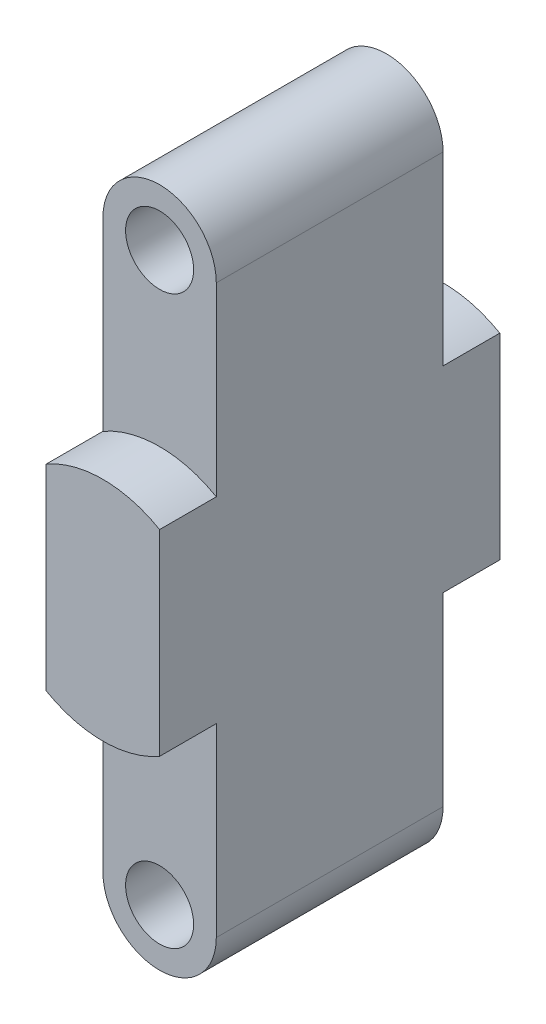
from build123d import *

# Parameters (mm, degrees)
SKETCH1_W                   = 12.7
SKETCH1_H                   = 38.1
BOSS_EXTRUDE1_DEPTH         = 19.05
FILLET2_RADIUS              = 6.35
FILLET2_LENGTH              = 38.1
SKETCH2_R                   = 3.81
CUT_EXTRUDE1_DEPTH          = 38.1
CUT_EXTRUDE2_DEPTH          = 6.35
MIRROR7_COPY_1_DEPTH        = 6.35
FILLET2_OF_MIRROR7_2_RADIUS = 6.35
FILLET2_OF_MIRROR7_2_LENGTH = 38.1


with BuildPart() as part:
    # Sketch1 → Boss-Extrude1 (new, symmetric)
    with BuildSketch(Plane.XY):
        Rectangle(SKETCH1_W, SKETCH1_H)
    boss_extrude1 = extrude(amount=BOSS_EXTRUDE1_DEPTH, both=True)

    # Fillet2: full round fillet: the end face becomes a half cylinder, R = half its width
    fillet2_face = Plane((0, -19.05, 0), x_dir=(0, 0, 1), z_dir=(0, -1, 0))  # on the end face: x along it, z out of the body
    fillet2_slab = fillet2_face.offset(-FILLET2_RADIUS / 2) * Box(FILLET2_LENGTH, 2 * FILLET2_RADIUS, FILLET2_RADIUS, mode=Mode.PRIVATE)  # the body's end, R deep
    fillet2_round = Plane((0, -12.7, 0), x_dir=(0, -1, 0), z_dir=(0, 0, 1)) * Cylinder(FILLET2_RADIUS, FILLET2_LENGTH, mode=Mode.PRIVATE)  # its axis R under the face
    add(fillet2_slab - fillet2_round, mode=Mode.SUBTRACT)

    # Sketch2 → Cut-Extrude1 (cut)
    with BuildSketch(Plane.XY.offset(19.05)):
        with Locations((0, -12.7)):
            Circle(SKETCH2_R)
    cut_extrude1 = extrude(amount=-CUT_EXTRUDE1_DEPTH, mode=Mode.SUBTRACT)

    # Sketch8 → Cut-Extrude2 (cut)
    with BuildSketch(Plane.XY.offset(19.05)):
        with BuildLine():
            Line((-12.7, 19.05), (-12.7, -58.61254398))
            Line((-12.7, -58.61254398), (12.7, -58.61254398))
            Line((12.7, -58.61254398), (12.7, 19.05))
            ThreePointArc((12.7, 19.05), (0, 6.35), (-12.7, 19.05))
        make_face()
    cut_extrude2 = extrude(amount=-CUT_EXTRUDE2_DEPTH, mode=Mode.SUBTRACT)

    # Mirror5: Cut-Extrude2 across plane
    add(cut_extrude2.mirror(Plane.XY), mode=Mode.SUBTRACT)

    # Mirror7: Boss-Extrude1, Cut-Extrude1, Cut-Extrude2 across plane
    add(boss_extrude1.mirror(Plane(origin=(-6.35, 19.05, 19.05), x_dir=(0, 0, 1), z_dir=(0, -1, 0))))
    add(cut_extrude1.mirror(Plane(origin=(-6.35, 19.05, 19.05), x_dir=(0, 0, 1), z_dir=(0, -1, 0))), mode=Mode.SUBTRACT)
    add(cut_extrude2.mirror(Plane(origin=(-6.35, 19.05, 19.05), x_dir=(0, 0, 1), z_dir=(0, -1, 0))), mode=Mode.SUBTRACT)

    # Mirror7 copy 1 sketch → Mirror7 copy 1 (cut)
    with BuildSketch(Plane(origin=(0, 38.1, -19.05), x_dir=(1, 0, 0), z_dir=(0, 0, -1))):
        with BuildLine():
            Line((-12.7, 19.05), (-12.7, -58.61254398))
            Line((-12.7, -58.61254398), (12.7, -58.61254398))
            Line((12.7, -58.61254398), (12.7, 19.05))
            ThreePointArc((12.7, 19.05), (0, 6.35), (-12.7, 19.05))
        make_face()
    extrude(amount=-MIRROR7_COPY_1_DEPTH, mode=Mode.SUBTRACT)

    # Fillet2 of Mirror7 2: full round fillet: the end face becomes a half cylinder, R = half its width
    fillet2_of_mirror7_2_face = Plane((0, 57.15, 0), x_dir=(0, 0, 1), z_dir=(0, 1, 0))  # on the end face: x along it, z out of the body
    fillet2_of_mirror7_2_slab = fillet2_of_mirror7_2_face.offset(-FILLET2_OF_MIRROR7_2_RADIUS / 2) * Box(FILLET2_OF_MIRROR7_2_LENGTH, 2 * FILLET2_OF_MIRROR7_2_RADIUS, FILLET2_OF_MIRROR7_2_RADIUS, mode=Mode.PRIVATE)  # the body's end, R deep
    fillet2_of_mirror7_2_round = Plane((0, 50.8, 0), x_dir=(0, 1, 0), z_dir=(0, 0, 1)) * Cylinder(FILLET2_OF_MIRROR7_2_RADIUS, FILLET2_OF_MIRROR7_2_LENGTH, mode=Mode.PRIVATE)  # its axis R under the face
    add(fillet2_of_mirror7_2_slab - fillet2_of_mirror7_2_round, mode=Mode.SUBTRACT)


solid = part.part
